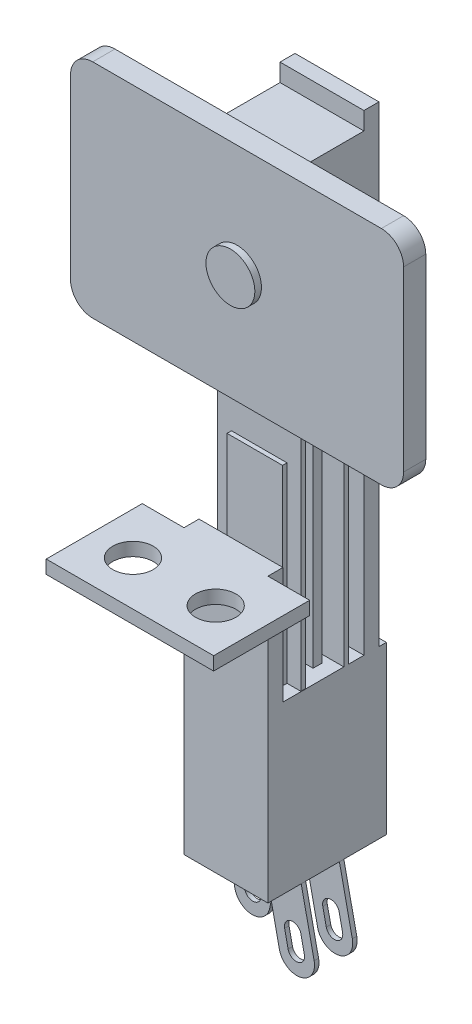
from build123d import *

# Parameters (mm, degrees)
SKETCH2_W              = 19.1516
SKETCH2_H              = 10.9855
SKETCH2_R              = 2.31775
BOSS_EXTRUDE1_DEPTH    = 1.524
SKETCH3_W              = 9.6012
SKETCH3_H              = 1.7145
BOSS_EXTRUDE2_DEPTH    = 32.385
SKETCH4_W              = 9.6012
SKETCH4_H              = 19.05
BOSS_EXTRUDE3_DEPTH    = 9.271
SKETCH5_W              = 9.6012
SKETCH5_H              = 73.025
BOSS_EXTRUDE4_DEPTH    = 1.7145
SKETCH6_W              = 9.6012
SKETCH6_H              = 19.05
BOSS_EXTRUDE5_DEPTH    = 0.8509
SKETCH7_W              = 6.35
SKETCH7_H              = 21.844
BOSS_EXTRUDE6_DEPTH    = 0.508
BOSS_EXTRUDE7_DEPTH    = 0.508
SKETCH9_W              = 6.35
SKETCH9_H              = 31.75
BOSS_EXTRUDE8_DEPTH    = 0.508
SKETCH10_W             = 6.35
SKETCH10_H             = 21.844
BOSS_EXTRUDE9_DEPTH    = 0.508
SKETCH11_W             = 9.6012
SKETCH11_H             = 31.75
BOSS_EXTRUDE10_DEPTH   = 0.508
BOSS_EXTRUDE11_DEPTH   = 2.54
SKETCH13_R             = 2.794
BOSS_EXTRUDE12_DEPTH   = 0.762
SKETCH14_W             = 9.6012
SKETCH14_H             = 19.05
BOSS_EXTRUDE13_DEPTH   = 6.6675
BOSS_EXTRUDE14_DEPTH   = 0.508
BOSS_EXTRUDE15_DEPTH   = 0.508
BOSS_EXTRUDE16_DEPTH   = 0.508
SKETCH19_R             = 2.794
BOSS_EXTRUDE17_DEPTH   = 0.8382
BOSS_EXTRUDE17_2_DEPTH = 0.8382


with BuildPart() as part:
    # Sketch2 → Boss-Extrude1 (new body)
    with BuildSketch(Plane(origin=(0, 0, 0), x_dir=(1, 0, 0), z_dir=(0, 1, 0))):
        with Locations((0, 5.49275)):
            Rectangle(SKETCH2_W, SKETCH2_H)
        with Locations(Location((-4.73075, 5.08, 0), (0, 0, 270))):
            Circle(SKETCH2_R, mode=Mode.SUBTRACT)
        with Locations(Location((4.73075, 5.08, 0), (0, 0, 270))):
            Circle(SKETCH2_R, mode=Mode.SUBTRACT)
    extrude(amount=-BOSS_EXTRUDE1_DEPTH)

    # Sketch3 → Boss-Extrude2 (add)
    with BuildSketch(Plane(origin=(0, 0, 0), x_dir=(1, 0, 0), z_dir=(0, 1, 0))):
        with Locations((0, 11.84275)):
            Rectangle(SKETCH3_W, SKETCH3_H)
    extrude(amount=-BOSS_EXTRUDE2_DEPTH)


with BuildPart() as body_2:
    # Sketch4 → Boss-Extrude3 (new body)
    with BuildSketch(Plane(origin=(0, 0, -12.7), x_dir=(-1, 0, 0), z_dir=(0, 0, -1))):
        with Locations((0, -22.86)):
            Rectangle(SKETCH4_W, SKETCH4_H)
    extrude(amount=BOSS_EXTRUDE3_DEPTH)

    # Sketch7 → Boss-Extrude6 (add)
    with BuildSketch(Plane(origin=(0, 0, -14.2875), x_dir=(-1, 0, 0), z_dir=(0, 0, -1))):
        with Locations((0, -2.413)):
            Rectangle(SKETCH7_W, SKETCH7_H)
    extrude(amount=BOSS_EXTRUDE6_DEPTH)

    # Sketch15 → Boss-Extrude14 (add)
    with BuildSketch(Plane(origin=(0, 0, -14.7955), x_dir=(-1, 0, 0), z_dir=(0, 0, -1))):
        with BuildLine():
            Line((-4.8006, -32.385), (-6.279341549, -39.273723719))
            ThreePointArc((-6.279341549, -39.273723719), (-4.719076281, -41.686941549), (-2.305858451, -40.126676281))
            Line((-2.305858451, -40.126676281), (-0.644021101, -32.385))
            Line((-0.644021101, -32.385), (-4.8006, -32.385))
        make_face()
        with BuildLine():
            Line((-2.90018742, -37.751946457), (-3.300008934, -39.614516659))
            ThreePointArc((-3.300008934, -39.614516659), (-4.431204791, -40.345891003), (-5.162579136, -39.214695145))
            Line((-5.162579136, -39.214695145), (-4.762757622, -37.352124944))
            ThreePointArc((-4.762757622, -37.352124944), (-3.631561764, -36.620750599), (-2.90018742, -37.751946457))
        make_face(mode=Mode.SUBTRACT)
    extrude(amount=BOSS_EXTRUDE14_DEPTH)

    # Sketch17 → Boss-Extrude15 (add)
    with BuildSketch(Plane(origin=(0, 0, -18.288), x_dir=(-1, 0, 0), z_dir=(0, 0, -1))):
        with BuildLine():
            Line((4.8006, -32.385), (6.279341549, -39.273723719))
            ThreePointArc((6.279341549, -39.273723719), (4.719076281, -41.686941549), (2.305858451, -40.126676281))
            Line((2.305858451, -40.126676281), (0.644021101, -32.385))
            Line((0.644021101, -32.385), (4.8006, -32.385))
        make_face()
        with BuildLine():
            Line((2.90018742, -37.751946457), (3.300008934, -39.614516659))
            ThreePointArc((3.300008934, -39.614516659), (4.431204791, -40.345891003), (5.162579136, -39.214695145))
            Line((5.162579136, -39.214695145), (4.762757622, -37.352124944))
            ThreePointArc((4.762757622, -37.352124944), (3.631561764, -36.620750599), (2.90018742, -37.751946457))
        make_face(mode=Mode.SUBTRACT)
    extrude(amount=BOSS_EXTRUDE15_DEPTH)

    # Sketch18 → Boss-Extrude16 (add)
    with BuildSketch(Plane.XY.offset(-19.6723)):
        with BuildLine():
            Line((4.8006, -32.385), (6.279341549, -39.273723719))
            ThreePointArc((6.279341549, -39.273723719), (4.719076281, -41.686941549), (2.305858451, -40.126676281))
            Line((2.305858451, -40.126676281), (0.644021101, -32.385))
            Line((0.644021101, -32.385), (4.8006, -32.385))
        make_face()
        with BuildLine():
            Line((2.90018742, -37.751946457), (3.300008934, -39.614516659))
            ThreePointArc((3.300008934, -39.614516659), (4.431204791, -40.345891003), (5.162579136, -39.214695145))
            Line((5.162579136, -39.214695145), (4.762757622, -37.352124944))
            ThreePointArc((4.762757622, -37.352124944), (3.631561764, -36.620750599), (2.90018742, -37.751946457))
        make_face(mode=Mode.SUBTRACT)
    extrude(amount=BOSS_EXTRUDE16_DEPTH)


with BuildPart() as body_3:
    # Sketch5 → Boss-Extrude4 (new body)
    with BuildSketch(Plane(origin=(0, 0, -21.971), x_dir=(-1, 0, 0), z_dir=(0, 0, -1))):
        with Locations((0, 4.1275)):
            Rectangle(SKETCH5_W, SKETCH5_H)
    extrude(amount=BOSS_EXTRUDE4_DEPTH)


with BuildPart() as body_4:
    # Sketch6 → Boss-Extrude5 (new body)
    with BuildSketch(Plane(origin=(0, 0, -23.6855), x_dir=(-1, 0, 0), z_dir=(0, 0, -1))):
        with Locations((0, -22.86)):
            Rectangle(SKETCH6_W, SKETCH6_H)
    extrude(amount=BOSS_EXTRUDE5_DEPTH)


with BuildPart() as body_5:
    # Sketch8 → Boss-Extrude7 (new body)
    with BuildSketch(Plane(origin=(0, 0, -14.7955), x_dir=(-1, 0, 0), z_dir=(0, 0, -1))):
        with BuildLine():
            Line((4.7625, -13.335), (-4.7625, -13.335))
            Line((-4.7625, -13.335), (-4.7625, 20.066))
            ThreePointArc((-4.7625, 20.066), (0, 35.345573323), (4.7625, 20.066))
            Line((4.7625, 20.066), (4.7625, -13.335))
        make_face()
    extrude(amount=BOSS_EXTRUDE7_DEPTH)

    # Sketch12 → Boss-Extrude11 (add)
    with BuildSketch(Plane.XY.offset(-14.7955)):
        with BuildLine():
            Line((-16.51, 14.263573323), (16.51, 14.263573323))
            ThreePointArc((16.51, 14.263573323), (18.306051224, 15.007522099), (19.05, 16.803573323))
            Line((19.05, 16.803573323), (19.05, 37.123573323))
            ThreePointArc((19.05, 37.123573323), (18.306051224, 38.919624547), (16.51, 39.663573323))
            Line((16.51, 39.663573323), (-16.51, 39.663573323))
            ThreePointArc((-16.51, 39.663573323), (-18.306051224, 38.919624547), (-19.05, 37.123573323))
            Line((-19.05, 37.123573323), (-19.05, 16.803573323))
            ThreePointArc((-19.05, 16.803573323), (-18.306051224, 15.007522099), (-16.51, 14.263573323))
        make_face()
    extrude(amount=BOSS_EXTRUDE11_DEPTH)

    # Sketch13 → Boss-Extrude12 (add)
    with BuildSketch(Plane.XY.offset(-12.2555)):
        with Locations(Location((0, 26.963573323, 0), (0, 0, 180))):
            Circle(SKETCH13_R)
    extrude(amount=BOSS_EXTRUDE12_DEPTH)


with BuildPart() as body_6:
    # Sketch9 → Boss-Extrude8 (new body)
    with BuildSketch(Plane(origin=(0, 0, -17.78), x_dir=(-1, 0, 0), z_dir=(0, 0, -1))):
        with Locations((0, 2.54)):
            Rectangle(SKETCH9_W, SKETCH9_H)
    extrude(amount=BOSS_EXTRUDE8_DEPTH)


with BuildPart() as body_7:
    # Sketch10 → Boss-Extrude9 (new body)
    with BuildSketch(Plane(origin=(0, 0, -18.288), x_dir=(-1, 0, 0), z_dir=(0, 0, -1))):
        with Locations((0, -2.413)):
            Rectangle(SKETCH10_W, SKETCH10_H)
    extrude(amount=BOSS_EXTRUDE9_DEPTH)


with BuildPart() as body_8:
    # Sketch11 → Boss-Extrude10 (new body)
    with BuildSketch(Plane(origin=(0, 0, -19.6723), x_dir=(-1, 0, 0), z_dir=(0, 0, -1))):
        with Locations((0, 2.54)):
            Rectangle(SKETCH11_W, SKETCH11_H)
    extrude(amount=BOSS_EXTRUDE10_DEPTH)


with BuildPart() as body_9:
    # Sketch14 → Boss-Extrude13 (new body)
    with BuildSketch(Plane.XY.offset(-21.971)):
        with Locations((0, 29.083)):
            Rectangle(SKETCH14_W, SKETCH14_H)
    extrude(amount=BOSS_EXTRUDE13_DEPTH)


with BuildPart() as body_10:
    # Sketch19 → Boss-Extrude17 (new body)
    with BuildSketch(Plane(origin=(0, 0, -24.5364), x_dir=(-1, 0, 0), z_dir=(0, 0, -1))):
        with Locations((0, -17.93875)):
            Circle(SKETCH19_R)
    extrude(amount=BOSS_EXTRUDE17_DEPTH)


with BuildPart() as body_11:
    # Sketch19 → Boss-Extrude17 2 (new body)
    with BuildSketch(Plane(origin=(0, 0, -24.5364), x_dir=(-1, 0, 0), z_dir=(0, 0, -1))):
        with Locations((0, -27.78125)):
            Circle(SKETCH19_R)
    extrude(amount=BOSS_EXTRUDE17_2_DEPTH)


with BuildPart() as part_1:
    add(part.part)

    # Combine1: union body 3, body 4, body 6, body 7, body 8, body 5, body 9, body 2, body 10, body 11
    add(body_3.part)
    add(body_4.part)
    add(body_6.part)
    add(body_7.part)
    add(body_8.part)
    add(body_5.part)
    add(body_9.part)
    add(body_2.part)
    add(body_10.part)
    add(body_11.part)


solid = part_1.part
